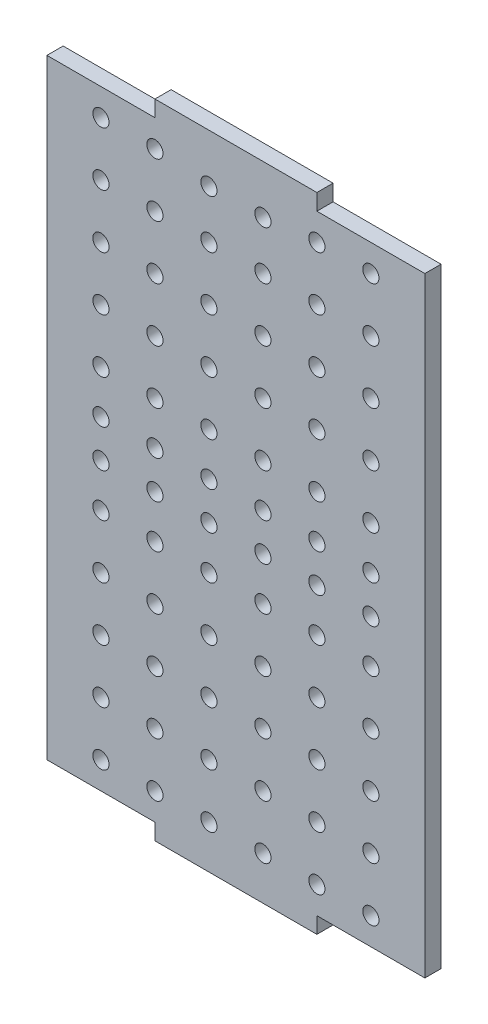
from build123d import *

# Parameters (mm, degrees)
SKETCH1_R           = 1.5
BOSS_EXTRUDE1_DEPTH = 3


with BuildPart() as part:
    # Sketch1 → Boss-Extrude1 (new body)
    with BuildSketch(Plane.XY):
        Polygon((-35, 56.5), (-35, -56.5), (-15, -56.5), (-15, -59.5), (15, -59.5), (15, -56.5), (35, -56.5), (35, 56.5), (25, 56.5), (15, 56.5), (15, 59.5), (5, 59.5), (-5, 59.5), (-15, 59.5), (-15, 56.5), (-25, 56.5), align=None)
        with Locations((-25, 51.5)):
            Circle(SKETCH1_R, mode=Mode.SUBTRACT)
        with Locations((-25, 41.5)):
            Circle(SKETCH1_R, mode=Mode.SUBTRACT)
        with Locations((-25, 31.5)):
            Circle(SKETCH1_R, mode=Mode.SUBTRACT)
        with Locations((-25, 21.5)):
            Circle(SKETCH1_R, mode=Mode.SUBTRACT)
        with Locations((-25, 11.5)):
            Circle(SKETCH1_R, mode=Mode.SUBTRACT)
        with Locations((-25, 3.5)):
            Circle(SKETCH1_R, mode=Mode.SUBTRACT)
        with Locations((-25, -3.5)):
            Circle(SKETCH1_R, mode=Mode.SUBTRACT)
        with Locations((-25, -11.5)):
            Circle(SKETCH1_R, mode=Mode.SUBTRACT)
        with Locations((-25, -21.5)):
            Circle(SKETCH1_R, mode=Mode.SUBTRACT)
        with Locations((-25, -31.5)):
            Circle(SKETCH1_R, mode=Mode.SUBTRACT)
        with Locations((-25, -51.5)):
            Circle(SKETCH1_R, mode=Mode.SUBTRACT)
        with Locations((-15, 51.5)):
            Circle(SKETCH1_R, mode=Mode.SUBTRACT)
        with Locations((-15, 41.5)):
            Circle(SKETCH1_R, mode=Mode.SUBTRACT)
        with Locations((-15, 31.5)):
            Circle(SKETCH1_R, mode=Mode.SUBTRACT)
        with Locations((-15, 21.5)):
            Circle(SKETCH1_R, mode=Mode.SUBTRACT)
        with Locations((-15, 11.5)):
            Circle(SKETCH1_R, mode=Mode.SUBTRACT)
        with Locations((-15, 3.5)):
            Circle(SKETCH1_R, mode=Mode.SUBTRACT)
        with Locations((-15, -3.5)):
            Circle(SKETCH1_R, mode=Mode.SUBTRACT)
        with Locations((-15, -11.5)):
            Circle(SKETCH1_R, mode=Mode.SUBTRACT)
        with Locations((-15, -21.5)):
            Circle(SKETCH1_R, mode=Mode.SUBTRACT)
        with Locations((-15, -31.5)):
            Circle(SKETCH1_R, mode=Mode.SUBTRACT)
        with Locations((-15, -51.5)):
            Circle(SKETCH1_R, mode=Mode.SUBTRACT)
        with Locations((-5, 50.5)):
            Circle(SKETCH1_R, mode=Mode.SUBTRACT)
        with Locations((-5, 41.5)):
            Circle(SKETCH1_R, mode=Mode.SUBTRACT)
        with Locations((-5, 31.5)):
            Circle(SKETCH1_R, mode=Mode.SUBTRACT)
        with Locations((-5, 21.5)):
            Circle(SKETCH1_R, mode=Mode.SUBTRACT)
        with Locations((-5, 11.5)):
            Circle(SKETCH1_R, mode=Mode.SUBTRACT)
        with Locations((-5, 3.5)):
            Circle(SKETCH1_R, mode=Mode.SUBTRACT)
        with Locations((-5, -3.5)):
            Circle(SKETCH1_R, mode=Mode.SUBTRACT)
        with Locations((-5, -11.5)):
            Circle(SKETCH1_R, mode=Mode.SUBTRACT)
        with Locations((-5, -21.5)):
            Circle(SKETCH1_R, mode=Mode.SUBTRACT)
        with Locations((-5, -31.5)):
            Circle(SKETCH1_R, mode=Mode.SUBTRACT)
        with Locations((-5, -51.5)):
            Circle(SKETCH1_R, mode=Mode.SUBTRACT)
        with Locations((5, 50.5)):
            Circle(SKETCH1_R, mode=Mode.SUBTRACT)
        with Locations((5, 41.5)):
            Circle(SKETCH1_R, mode=Mode.SUBTRACT)
        with Locations((5, 31.5)):
            Circle(SKETCH1_R, mode=Mode.SUBTRACT)
        with Locations((5, 21.5)):
            Circle(SKETCH1_R, mode=Mode.SUBTRACT)
        with Locations((5, 11.5)):
            Circle(SKETCH1_R, mode=Mode.SUBTRACT)
        with Locations((5, 3.5)):
            Circle(SKETCH1_R, mode=Mode.SUBTRACT)
        with Locations((5, -3.5)):
            Circle(SKETCH1_R, mode=Mode.SUBTRACT)
        with Locations((5, -11.5)):
            Circle(SKETCH1_R, mode=Mode.SUBTRACT)
        with Locations((5, -21.5)):
            Circle(SKETCH1_R, mode=Mode.SUBTRACT)
        with Locations((5, -31.5)):
            Circle(SKETCH1_R, mode=Mode.SUBTRACT)
        with Locations((5, -51.5)):
            Circle(SKETCH1_R, mode=Mode.SUBTRACT)
        with Locations((15, 51.5)):
            Circle(SKETCH1_R, mode=Mode.SUBTRACT)
        with Locations((15, 41.5)):
            Circle(SKETCH1_R, mode=Mode.SUBTRACT)
        with Locations((15, 31.5)):
            Circle(SKETCH1_R, mode=Mode.SUBTRACT)
        with Locations((15, 21.5)):
            Circle(SKETCH1_R, mode=Mode.SUBTRACT)
        with Locations((15, 11.5)):
            Circle(SKETCH1_R, mode=Mode.SUBTRACT)
        with Locations((15, 3.5)):
            Circle(SKETCH1_R, mode=Mode.SUBTRACT)
        with Locations((15, -3.5)):
            Circle(SKETCH1_R, mode=Mode.SUBTRACT)
        with Locations((15, -11.5)):
            Circle(SKETCH1_R, mode=Mode.SUBTRACT)
        with Locations((15, -21.5)):
            Circle(SKETCH1_R, mode=Mode.SUBTRACT)
        with Locations((15, -31.5)):
            Circle(SKETCH1_R, mode=Mode.SUBTRACT)
        with Locations((15, -51.5)):
            Circle(SKETCH1_R, mode=Mode.SUBTRACT)
        with Locations((25, 51.5)):
            Circle(SKETCH1_R, mode=Mode.SUBTRACT)
        with Locations((25, 41.5)):
            Circle(SKETCH1_R, mode=Mode.SUBTRACT)
        with Locations((25, 31.5)):
            Circle(SKETCH1_R, mode=Mode.SUBTRACT)
        with Locations((25, 21.5)):
            Circle(SKETCH1_R, mode=Mode.SUBTRACT)
        with Locations((25, 11.5)):
            Circle(SKETCH1_R, mode=Mode.SUBTRACT)
        with Locations((25, 3.5)):
            Circle(SKETCH1_R, mode=Mode.SUBTRACT)
        with Locations((25, -3.5)):
            Circle(SKETCH1_R, mode=Mode.SUBTRACT)
        with Locations((25, -11.5)):
            Circle(SKETCH1_R, mode=Mode.SUBTRACT)
        with Locations((25, -21.5)):
            Circle(SKETCH1_R, mode=Mode.SUBTRACT)
        with Locations((25, -31.5)):
            Circle(SKETCH1_R, mode=Mode.SUBTRACT)
        with Locations((25, -51.5)):
            Circle(SKETCH1_R, mode=Mode.SUBTRACT)
        with Locations((-25, -41.5)):
            Circle(SKETCH1_R, mode=Mode.SUBTRACT)
        with Locations((-15, -41.5)):
            Circle(SKETCH1_R, mode=Mode.SUBTRACT)
        with Locations((-5, -41.5)):
            Circle(SKETCH1_R, mode=Mode.SUBTRACT)
        with Locations((5, -41.5)):
            Circle(SKETCH1_R, mode=Mode.SUBTRACT)
        with Locations((15, -41.5)):
            Circle(SKETCH1_R, mode=Mode.SUBTRACT)
        with Locations((25, -41.5)):
            Circle(SKETCH1_R, mode=Mode.SUBTRACT)
    extrude(amount=BOSS_EXTRUDE1_DEPTH)


solid = part.part
